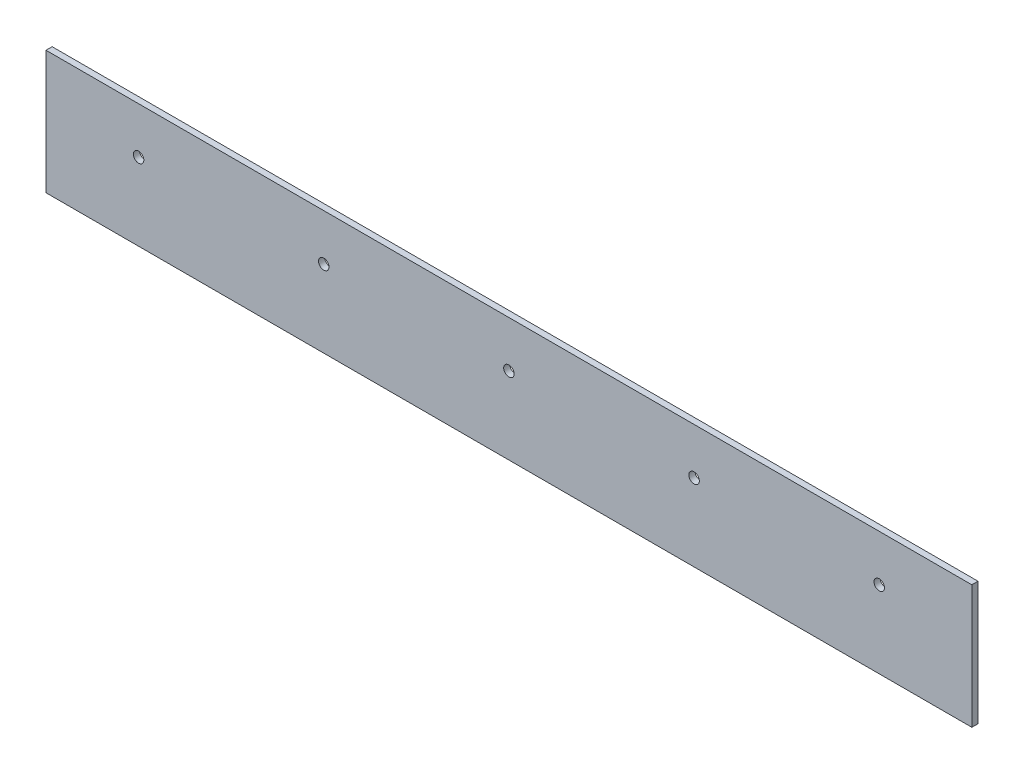
from build123d import *

# Parameters (mm, degrees)
SKETCH1_W           = 1500
SKETCH1_H           = 200
SKETCH1_R           = 8.5
BOSS_EXTRUDE1_DEPTH = 10


with BuildPart() as part:
    # Sketch1 → Boss-Extrude1 (new body)
    with BuildSketch(Plane.XY):
        with Locations((750, 100)):
            Rectangle(SKETCH1_W, SKETCH1_H)
        with Locations((150, 125)):
            Circle(SKETCH1_R, mode=Mode.SUBTRACT)
        with Locations((450, 125)):
            Circle(SKETCH1_R, mode=Mode.SUBTRACT)
        with Locations((750, 125)):
            Circle(SKETCH1_R, mode=Mode.SUBTRACT)
        with Locations((1050, 125)):
            Circle(SKETCH1_R, mode=Mode.SUBTRACT)
        with Locations((1350, 125)):
            Circle(SKETCH1_R, mode=Mode.SUBTRACT)
    extrude(amount=BOSS_EXTRUDE1_DEPTH)


solid = part.part
